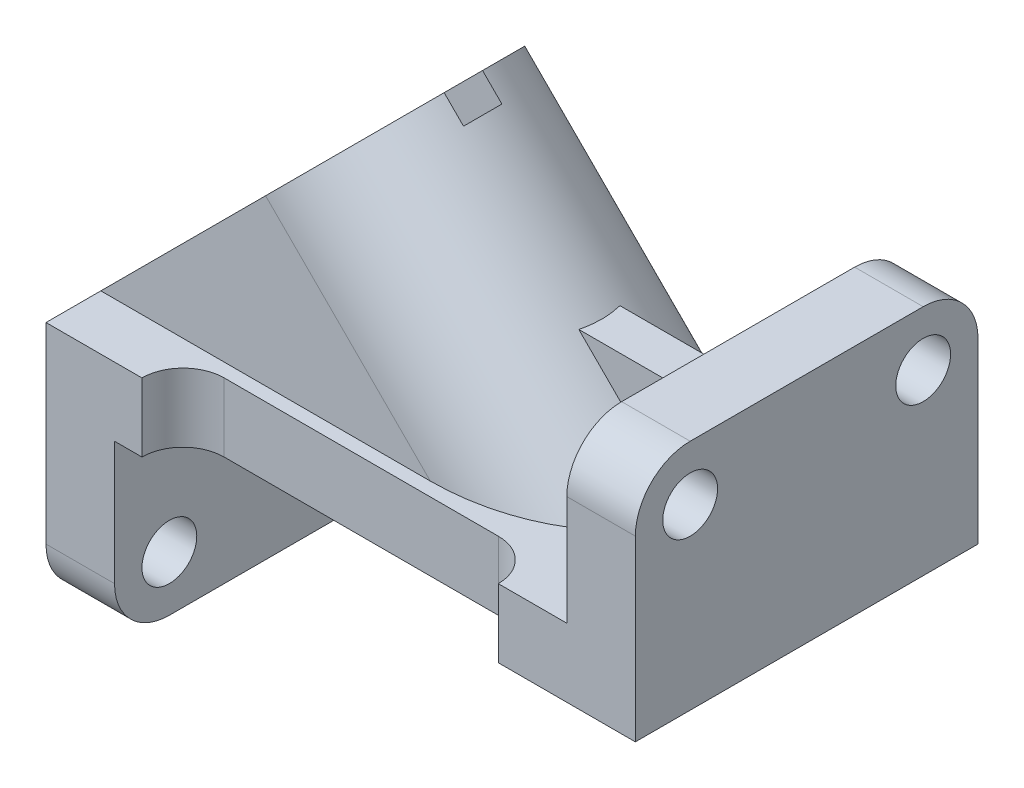
from build123d import *

# Parameters (mm, degrees)
BOSS_EXTRUDE1_DEPTH = 62.5
FILLET1_R           = 20
SKETCH2_R           = 10
CUT_EXTRUDE1_DEPTH  = 240.491649124
SKETCH3_R           = 10
CUT_EXTRUDE2_DEPTH  = 125
SKETCH4_W           = 148.086919985
SKETCH4_H           = 40
BOSS_EXTRUDE2_DEPTH = 7.5
BOSS_EXTRUDE3_REACH = 243.312
CUT_EXTRUDE3_REACH  = 221.395
CUT_EXTRUDE4_DEPTH  = 10


with BuildPart() as part:
    # Sketch1 → Boss-Extrude1 (new, symmetric)
    with BuildSketch(Plane.XY):
        Polygon((0, 0), (190, 0), (190, 85), (165, 85), (165, 25), (-25, 25), (-25, -65), (0, -65), align=None)
    extrude(amount=BOSS_EXTRUDE1_DEPTH, both=True)

    # Fillet1
    fillet1_edges = [part.edges().sort_by_distance(p)[0] for p in [
        (177.5, 85, -62.5),
        (177.5, 85, 62.5),
        (-12.5, -65, 62.5),
        (-12.5, -65, -62.5),
    ]]
    fillet(fillet1_edges, radius=FILLET1_R)

    # Sketch2 → Cut-Extrude1 (cut, through all)
    with BuildSketch(Plane(origin=(190, 0, 0), x_dir=(0, 0, -1), z_dir=(1, 0, 0))):
        with Locations((42.5, 65)):
            Circle(SKETCH2_R)
        with Locations((-42.5, 65)):
            Circle(SKETCH2_R)
    extrude(amount=-CUT_EXTRUDE1_DEPTH, mode=Mode.SUBTRACT)

    # Sketch3 → Cut-Extrude2 (cut)
    with BuildSketch(Plane.ZY.offset(25)):
        with Locations(Location((42.5, -45, 0), (0, 0, 270))):
            Circle(SKETCH3_R)
        with Locations(Location((-42.5, -45, 0), (0, 0, 270))):
            Circle(SKETCH3_R)
    extrude(amount=-CUT_EXTRUDE2_DEPTH, mode=Mode.SUBTRACT)

    # Sketch4 → Boss-Extrude2 (add, symmetric)
    with BuildSketch(Plane.XY):
        with Locations((90.956540007, 45)):
            Rectangle(SKETCH4_W, SKETCH4_H)
    extrude(amount=BOSS_EXTRUDE2_DEPTH, both=True)

    # Sketch5 → Boss-Extrude3 (add, up to next)
    with BuildSketch(Plane(origin=(-25, 25, 0), x_dir=(0, 0, -1), z_dir=(-0.707106781186549, 0.7071067811865461, 0)), mode=Mode.PRIVATE) as boss_extrude3_sk1:
        with BuildLine():
            Line((-42.5, 0), (-42.5, -85))
            ThreePointArc((-42.5, -85), (0, -127.5), (42.5, -85))
            Line((42.5, -85), (42.5, 0))
            Line((42.5, 0), (-42.5, 0))
        make_face()
    boss_extrude3_tool1 = extrude(boss_extrude3_sk1.sketch, amount=-BOSS_EXTRUDE3_REACH, mode=Mode.PRIVATE) - part.part
    add(boss_extrude3_tool1.solids().sort_by_distance((17.122184, 67.122184, 0))[0])

    # Sketch7 → Cut-Extrude3 (cut, up to next)
    with BuildSketch(Plane(origin=(0, 25, 0), x_dir=(1, 0, 0), z_dir=(0, 1, 0)), mode=Mode.PRIVATE) as cut_extrude3_sk1:
        with BuildLine():
            Line((25, -47.5), (125, -47.5))
            ThreePointArc((125, -47.5), (135.606601718, -51.893398282), (140, -62.5))
            Line((140, -62.5), (10, -62.5))
            ThreePointArc((10, -62.5), (14.393398282, -51.893398282), (25, -47.5))
        make_face()
    cut_extrude3_tool1 = extrude(cut_extrude3_sk1.sketch, amount=-CUT_EXTRUDE3_REACH, mode=Mode.PRIVATE) & part.part
    cut_extrude3 = cut_extrude3_tool1.solids().sort_by_distance((75, 25, 55.216204))[0]
    add(cut_extrude3, mode=Mode.SUBTRACT)

    # Mirror1: Cut-Extrude3 across plane
    add(cut_extrude3.mirror(Plane.XY), mode=Mode.SUBTRACT)

    # Sketch8 → Cut-Extrude4 (cut)
    with BuildSketch(Plane(origin=(-25, 25, 0), x_dir=(0, 0, 1), z_dir=(-0.7071067811865489, 0.7071067811865462, 0))):
        with BuildLine():
            Line((-7, -26.74015117), (-7, 126.919565837))
            ThreePointArc((-7, 126.919565837), (0, 127.5), (7, 126.919565837))
            Line((7, 126.919565837), (7, -26.74015117))
            Line((7, -26.74015117), (-7, -26.74015117))
        make_face()
    extrude(amount=-CUT_EXTRUDE4_DEPTH, mode=Mode.SUBTRACT)

    # Sketch13 → CBORE for M24 Hex Head Bolt2 (revolve, cut)
    with BuildSketch(Plane(origin=(35.104076401, 85.104076401, 0), x_dir=(-0.7071067811865462, -0.7071067811865489, 0), z_dir=(0, 0, 1))):
        Polygon((0, 0), (0, 215.667568262), (13, 215.667568262), (13, 15.9), (22.285, 15.9), (22.285, 0.025), (22.31, 0), align=None)
    revolve(axis=Axis((30.61394834, 89.594204461, 0), (0.7071067811865489, -0.7071067811865462, 0)), mode=Mode.SUBTRACT)


solid = part.part
